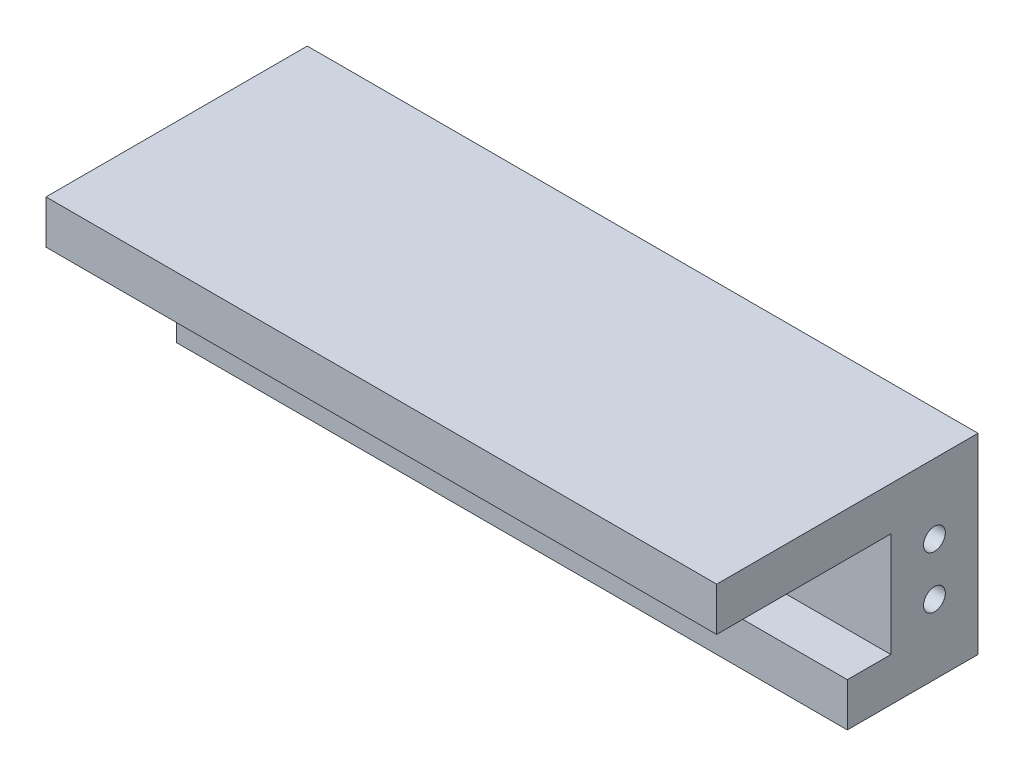
from build123d import *

# Parameters (mm, degrees)
SKETCH1_W           = 77
SKETCH1_H           = 12
BOSS_EXTRUDE1_DEPTH = 10
SKETCH2_R           = 1.25
CUT_EXTRUDE1_DEPTH  = 12
SKETCH3_W           = 77
SKETCH3_H           = 20
BOSS_EXTRUDE2_DEPTH = 5
SKETCH4_W           = 30
SKETCH4_H           = 6
CUT_EXTRUDE2_DEPTH  = 10
SKETCH5_W           = 78
SKETCH5_H           = 5
CUT_EXTRUDE3_DEPTH  = 5
CUT_EXTRUDE4_DEPTH  = 12
SKETCH8_W           = 77
SKETCH8_H           = 5
BOSS_EXTRUDE3_DEPTH = 10


with BuildPart() as part:
    # Sketch1 → Boss-Extrude1 (new body)
    with BuildSketch(Plane.XY):
        with Locations((38.5, 6)):
            Rectangle(SKETCH1_W, SKETCH1_H)
    extrude(amount=BOSS_EXTRUDE1_DEPTH)

    # Sketch2 → Cut-Extrude1 (cut)
    with BuildSketch(Plane(origin=(77, 0, 0), x_dir=(0, 0, -1), z_dir=(1, 0, 0))):
        with Locations((-5, 3)):
            Circle(SKETCH2_R)
        with Locations((-5, 9)):
            Circle(SKETCH2_R)
    extrude(amount=-CUT_EXTRUDE1_DEPTH, mode=Mode.SUBTRACT)

    # Sketch3 → Boss-Extrude2 (add)
    with BuildSketch(Plane(origin=(0, 12, 0), x_dir=(1, 0, 0), z_dir=(0, 1, 0))):
        with Locations((38.5, -10)):
            Rectangle(SKETCH3_W, SKETCH3_H)
    boss_extrude2 = extrude(amount=BOSS_EXTRUDE2_DEPTH)

    # Mirror2: Boss-Extrude2 across plane
    add(boss_extrude2.mirror(Plane(origin=(0, 6, 0), x_dir=(0, 0, 1), z_dir=(0, -1, 0))))

    # Sketch4 → Cut-Extrude2 (cut)
    with BuildSketch(Plane(origin=(0, 0, 0), x_dir=(-1, 0, 0), z_dir=(0, 0, -1))):
        with Locations((-38.5, 9)):
            Rectangle(SKETCH4_W, SKETCH4_H)
        with Locations((-38.5, 3)):
            Rectangle(SKETCH4_W, SKETCH4_H)
    extrude(amount=-CUT_EXTRUDE2_DEPTH, mode=Mode.SUBTRACT)

    # Sketch5 → Cut-Extrude3 (cut)
    with BuildSketch(Plane.XY.offset(20)):
        with Locations((38.5, -2.5)):
            Rectangle(SKETCH5_W, SKETCH5_H)
    extrude(amount=-CUT_EXTRUDE3_DEPTH, mode=Mode.SUBTRACT)

    # Sketch6 → Cut-Extrude4 (cut)
    with BuildSketch(Plane.ZY):
        with BuildLine():
            ThreePointArc((3.75, 6), (5, 4.75), (6.25, 6))
            Line((6.25, 6), (3.75, 6))
        make_face()
        with BuildLine():
            Line((3.75, 6), (6.25, 6))
            ThreePointArc((6.25, 6), (5, 7.25), (3.75, 6))
        make_face()
    extrude(amount=-CUT_EXTRUDE4_DEPTH, mode=Mode.SUBTRACT)

    # Sketch8 → Boss-Extrude3 (add)
    with BuildSketch(Plane.XY.offset(20)):
        with Locations((38.5, 14.5)):
            Rectangle(SKETCH8_W, SKETCH8_H)
    extrude(amount=BOSS_EXTRUDE3_DEPTH)


solid = part.part
